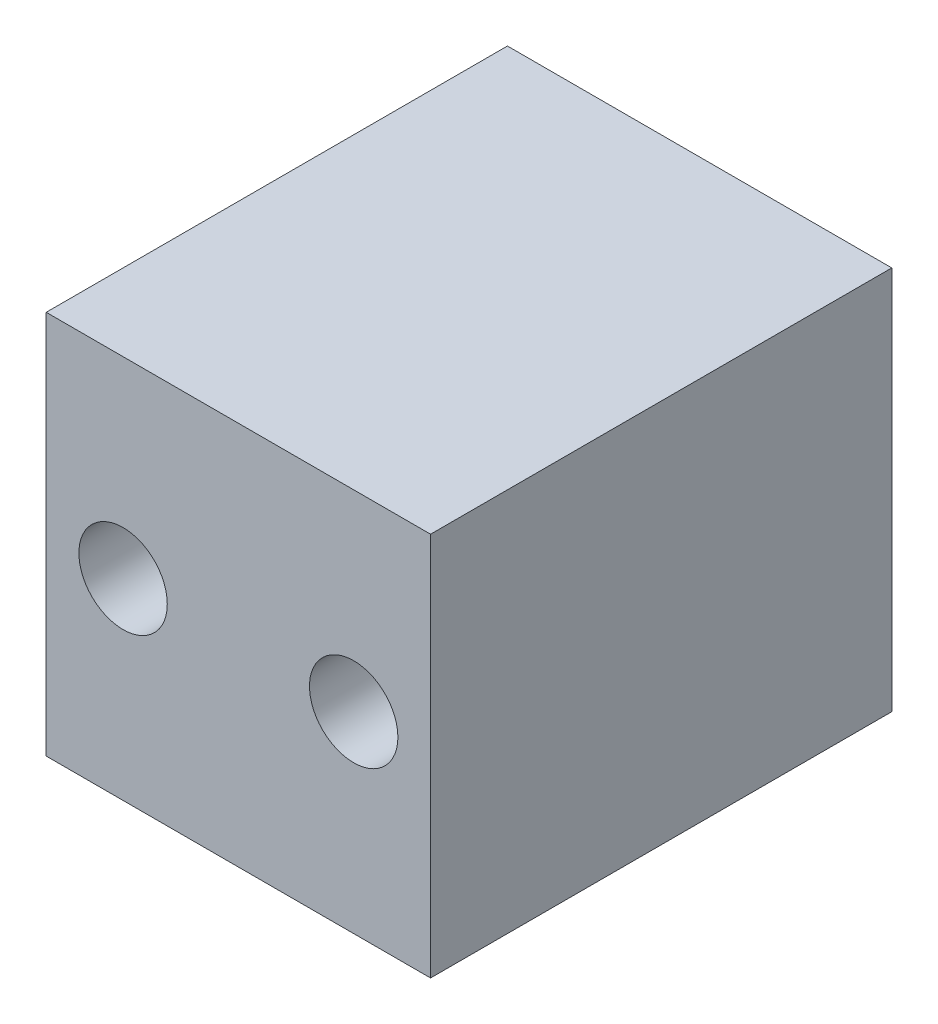
from build123d import *

# Parameters (mm, degrees)
SKIZZE1_W                                           = 100
SKIZZE1_H                                           = 100
AUFSATZ_LINEAR_AUSTRAGEN1_DEPTH                     = 120
STIRNSENKUNG_F_R_M8_SENKSCHRAUBE_KOPF_B_D           = 9
STIRNSENKUNG_F_R_M8_SENKSCHRAUBE_KOPF_B_CBORE_D     = 23
STIRNSENKUNG_F_R_M8_SENKSCHRAUBE_KOPF_B_CBORE_DEPTH = 110


with BuildPart() as part:
    # Skizze1 → Aufsatz-Linear austragen1 (new body)
    with BuildSketch(Plane.XY):
        Rectangle(SKIZZE1_W, SKIZZE1_H)
    extrude(amount=AUFSATZ_LINEAR_AUSTRAGEN1_DEPTH)

    # Stirnsenkung für M8 Senkschraube (Kopf Button)1 (through all)
    with Locations(Plane.XY.offset(120)):
        with Locations((-30, 0)):
            stirnsenkung_f_r_m8_senkschraube_kopf_b = CounterBoreHole(STIRNSENKUNG_F_R_M8_SENKSCHRAUBE_KOPF_B_D / 2, STIRNSENKUNG_F_R_M8_SENKSCHRAUBE_KOPF_B_CBORE_D / 2, STIRNSENKUNG_F_R_M8_SENKSCHRAUBE_KOPF_B_CBORE_DEPTH)

    # Spiegeln1: Stirnsenkung für M8 Senkschraube (Kopf Button)1 across plane
    add(stirnsenkung_f_r_m8_senkschraube_kopf_b.mirror(Plane(origin=(0, 0, 0), x_dir=(0, 0, 1), z_dir=(1, 0, 0))), mode=Mode.SUBTRACT)


solid = part.part
